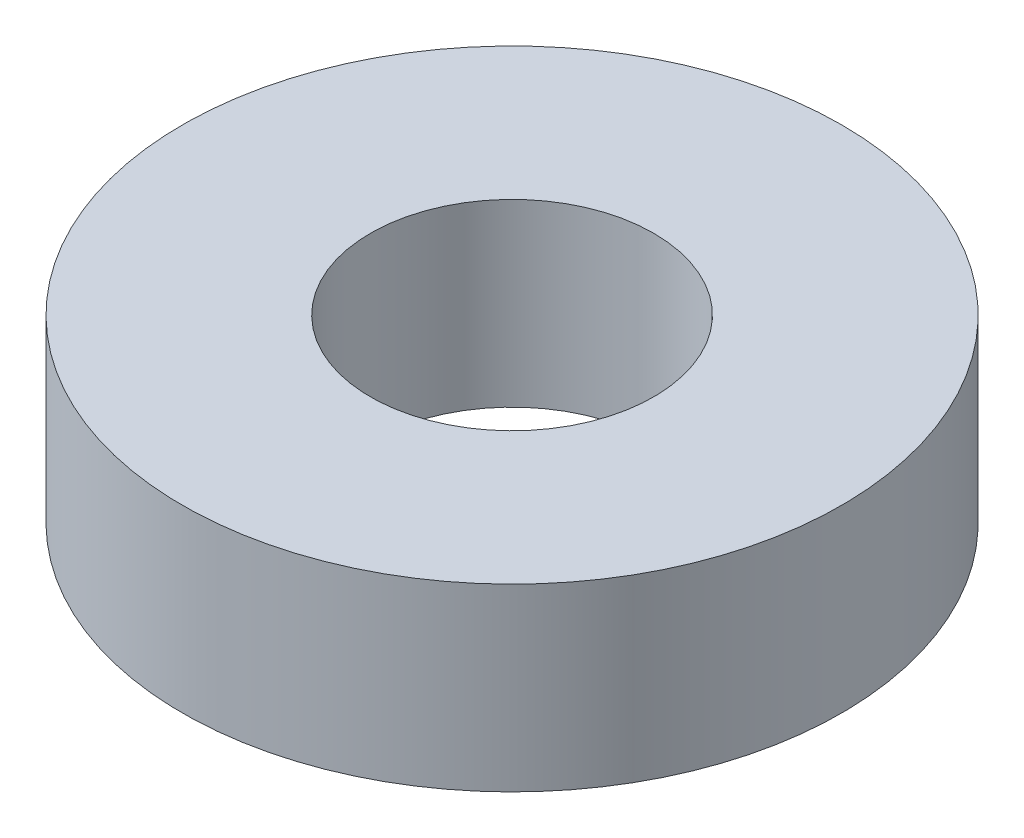
from build123d import *

# Parameters (mm, degrees)
IZIM2_R                     = 13.92
IZIM2_R_2                   = 5.985
Y_KSEKLIK_EKSTR_ZYON1_DEPTH = 7.6


with BuildPart() as part:
    # Çizim2 → Yükseklik-Ekstrüzyon1 (new body)
    with BuildSketch(Plane(origin=(0, 0, 0), x_dir=(1, 0, 0), z_dir=(0, 1, 0))):
        with Locations(Location((0, 0, 0), (0, 0, 90))):
            Circle(IZIM2_R)
        with Locations(Location((0, 0, 0), (0, 0, 90))):
            Circle(IZIM2_R_2, mode=Mode.SUBTRACT)
    extrude(amount=Y_KSEKLIK_EKSTR_ZYON1_DEPTH)


solid = part.part
